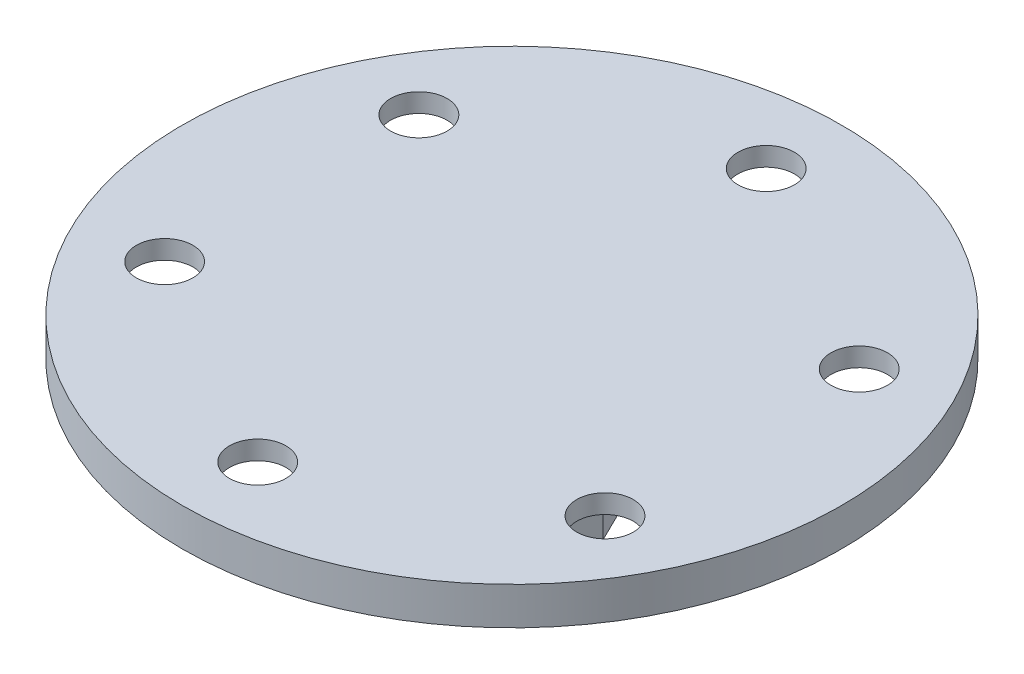
from build123d import *

# Parameters (mm, degrees)
SKETCH_1_R          = 17.5
SKETCH_1_R_2        = 1.5
EXTRUDE_1_DEPTH     = 2
EXTRUDE_2_DEPTH     = 6
SKETCH_5_R          = 3
CUT_EXTRUDE_1_DEPTH = 1


with BuildPart() as part:
    # 草图1 → 凸台-拉伸1 (new body)
    with BuildSketch(Plane(origin=(0, 0, 0), x_dir=(1, 0, 0), z_dir=(0, 1, 0))):
        with Locations(Location((0, 0, 0), (0, 0, 270))):
            Circle(SKETCH_1_R)
        with Locations(Location((0, -13.5, 0), (0, 0, 270))):
            Circle(SKETCH_1_R_2, mode=Mode.SUBTRACT)
        with Locations(Location((-11.691342951, -6.75, 0), (0, 0, 270))):
            Circle(SKETCH_1_R_2, mode=Mode.SUBTRACT)
        with Locations(Location((-11.691342951, 6.75, 0), (0, 0, 270))):
            Circle(SKETCH_1_R_2, mode=Mode.SUBTRACT)
        with Locations(Location((0, 13.5, 0), (0, 0, 270))):
            Circle(SKETCH_1_R_2, mode=Mode.SUBTRACT)
        with Locations(Location((11.691342951, 6.75, 0), (0, 0, 270))):
            Circle(SKETCH_1_R_2, mode=Mode.SUBTRACT)
        with Locations(Location((11.691342951, -6.75, 0), (0, 0, 270))):
            Circle(SKETCH_1_R_2, mode=Mode.SUBTRACT)
    extrude(amount=EXTRUDE_1_DEPTH)

    # 草图4 → 凸台-拉伸2 (add)
    with BuildSketch(Plane.XZ):
        Polygon((-2.985497273, 3.681012496), (-4.738451875, 0.10060218), (-3.681012496, -2.985497273), (-0.10060218, -4.738451875), (2.985497273, -3.681012496), (4.738451875, -0.10060218), (3.681012496, 2.985497273), (0.10060218, 4.738451875), align=None)
        with BuildLine():
            Line((-0.412394562, 2.97706408), (-1.500063983, 2.604378593))
            ThreePointArc((-1.500063983, 2.604378593), (-1.854278529, 2.39852018), (-2.102751494, 2.072779767))
            Line((-2.102751494, 2.072779767), (-2.926796788, 0.389666998))
            ThreePointArc((-2.926796788, 0.389666998), (-3.031700416, -0.006364389), (-2.97706408, -0.412394562))
            Line((-2.97706408, -0.412394562), (-2.604378593, -1.500063983))
            ThreePointArc((-2.604378593, -1.500063983), (-2.39852018, -1.854278529), (-2.072779767, -2.102751494))
            Line((-2.072779767, -2.102751494), (-0.389666998, -2.926796788))
            ThreePointArc((-0.389666998, -2.926796788), (0.006364389, -3.031700416), (0.412394562, -2.97706408))
            Line((0.412394562, -2.97706408), (1.500063983, -2.604378593))
            ThreePointArc((1.500063983, -2.604378593), (1.854278529, -2.39852018), (2.102751494, -2.072779767))
            Line((2.102751494, -2.072779767), (2.926796788, -0.389666998))
            ThreePointArc((2.926796788, -0.389666998), (3.031700416, 0.006364389), (2.97706408, 0.412394562))
            Line((2.97706408, 0.412394562), (2.604378593, 1.500063983))
            ThreePointArc((2.604378593, 1.500063983), (2.39852018, 1.854278529), (2.072779767, 2.102751494))
            Line((2.072779767, 2.102751494), (0.389666998, 2.926796788))
            ThreePointArc((0.389666998, 2.926796788), (-0.006364389, 3.031700416), (-0.412394562, 2.97706408))
        make_face(mode=Mode.SUBTRACT)
    extrude(amount=EXTRUDE_2_DEPTH)

    # 草图5 → 切除-拉伸1 (cut)
    with BuildSketch(Plane.XZ):
        with Locations(Location((-11.691342951, 6.75, 0), (0, 0, 270))):
            Circle(SKETCH_5_R)
        with Locations(Location((0, 13.5, 0), (0, 0, 270))):
            Circle(SKETCH_5_R)
        with Locations(Location((11.691342951, 6.75, 0), (0, 0, 270))):
            Circle(SKETCH_5_R)
        with Locations(Location((11.691342951, -6.75, 0), (0, 0, 270))):
            Circle(SKETCH_5_R)
        with Locations(Location((0, -13.5, 0), (0, 0, 270))):
            Circle(SKETCH_5_R)
        with Locations(Location((-11.691342951, -6.75, 0), (0, 0, 270))):
            Circle(SKETCH_5_R)
    extrude(amount=-CUT_EXTRUDE_1_DEPTH, mode=Mode.SUBTRACT)


solid = part.part
